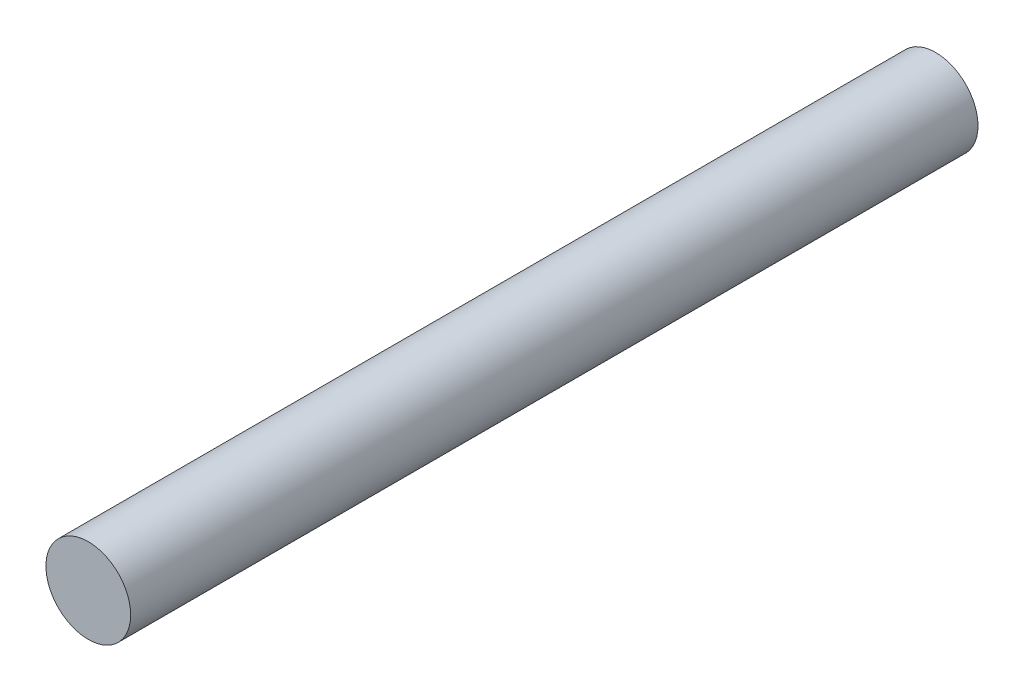
from build123d import *

# Parameters (mm, degrees)
SKETCH_1_R      = 1
EXTRUDE_1_DEPTH = 10


with BuildPart() as part:
    # 草图1 → 凸台-拉伸1 (new, symmetric)
    with BuildSketch(Plane.XY):
        Circle(SKETCH_1_R)
    extrude(amount=EXTRUDE_1_DEPTH, both=True)


solid = part.part
